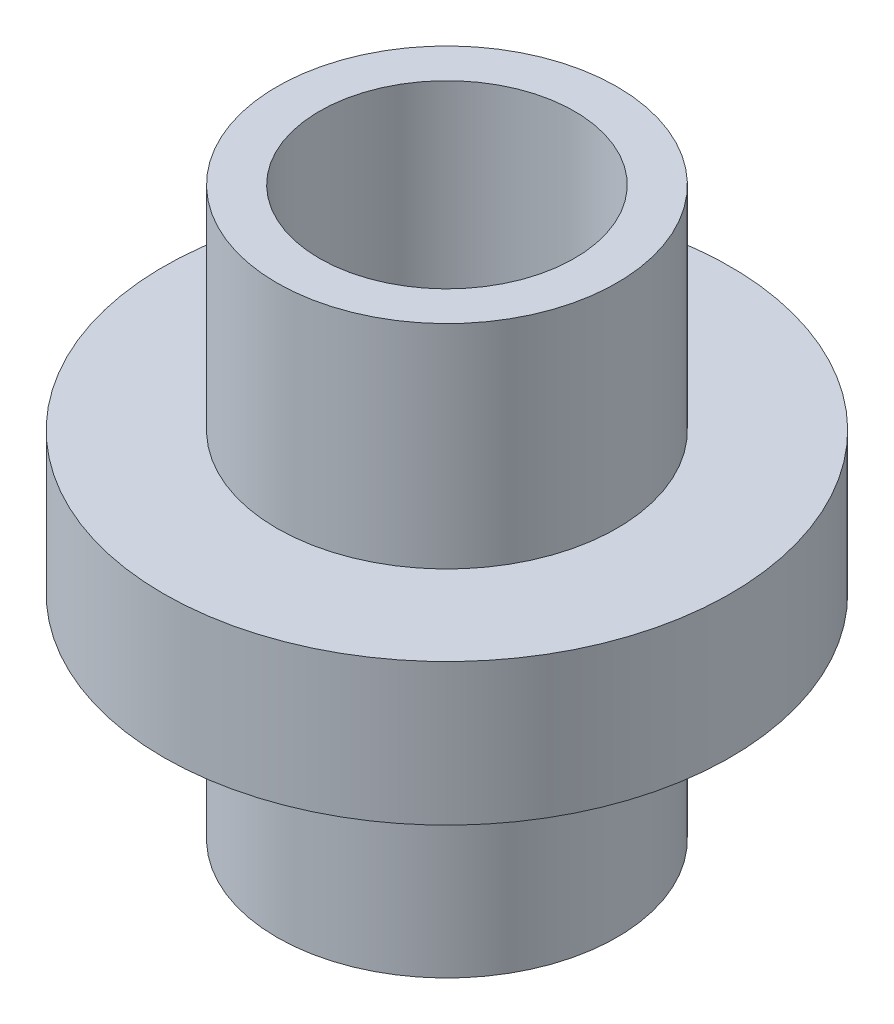
from build123d import *


with BuildPart() as part:
    # Sketch1 → Revolve1 (revolve)
    with BuildSketch(Plane.XY, mode=Mode.PRIVATE) as revolve1_sk:
        Polygon((4.5, 10), (6, 10), (6, 2.5), (10, 2.5), (10, -2.5), (6, -2.5), (6, -10), (4.5, -10), align=None)
    revolve(revolve1_sk.sketch.rotate(Axis((0, 10, 0), (0, -1, 0)), 90), axis=Axis((0, 10, 0), (0, -1, 0)))


solid = part.part
